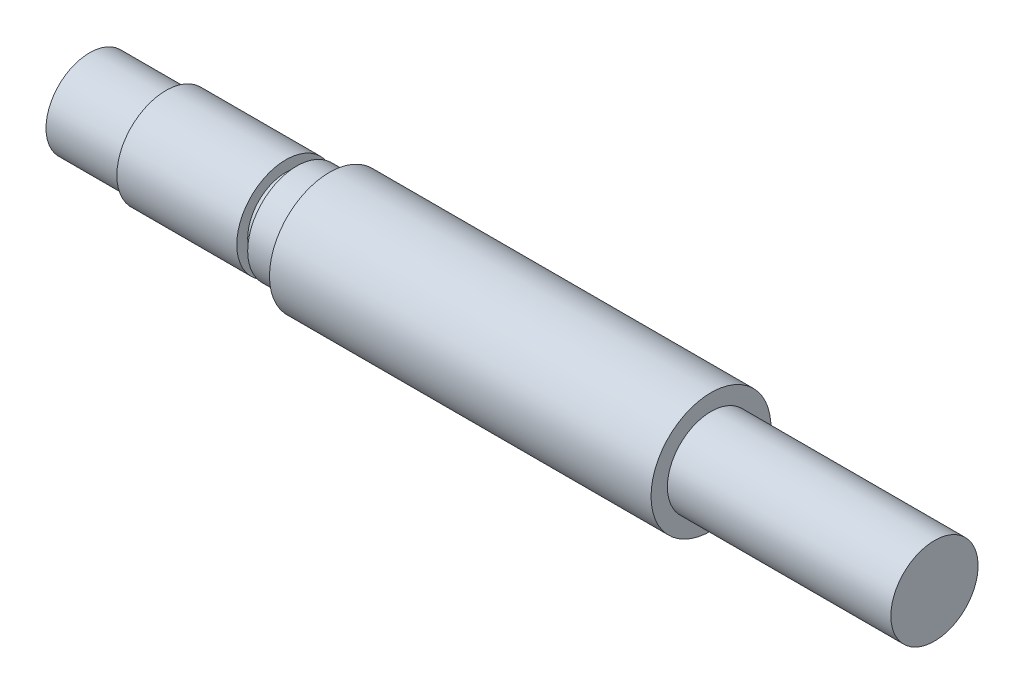
from build123d import *


with BuildPart() as part:
    # Esquisse1 → Révolution1 (revolve)
    with BuildSketch(Plane.XY, mode=Mode.PRIVATE) as r_volution1_sk:
        Polygon((0, 0), (0, 4), (7, 4), (7, 4.5), (18, 4.5), (18, 3.5), (19, 3.5), (19, 4.5), (22, 4.5), (22, 5.5), (57, 5.5), (57, 4), (77.5, 4), (77.5, 0), align=None)
    revolve(r_volution1_sk.sketch.rotate(Axis((0, 0, 0), (1, 0, 0)), 90), axis=Axis((0, 0, 0), (1, 0, 0)))


solid = part.part
